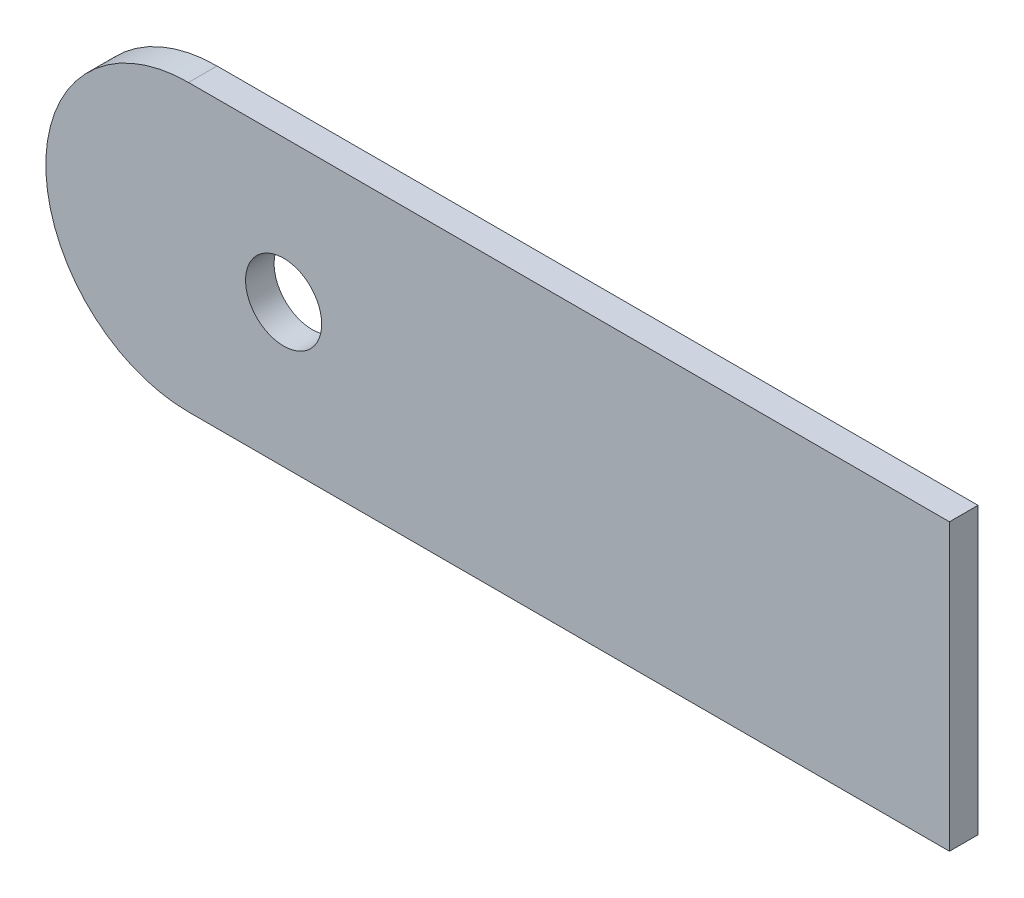
from build123d import *

# Parameters (mm, degrees)
SKETCH1_R           = 4
BOSS_EXTRUDE1_DEPTH = 3


with BuildPart() as part:
    # Sketch1 → Boss-Extrude1 (new body)
    with BuildSketch(Plane.XY):
        with BuildLine():
            Line((-40, 15), (40, 15))
            Line((40, 15), (40, -15))
            Line((40, -15), (-40, -15))
            ThreePointArc((-40, -15), (-55, 0), (-40, 15))
        make_face()
        with Locations((-30, 0)):
            Circle(SKETCH1_R, mode=Mode.SUBTRACT)
    extrude(amount=BOSS_EXTRUDE1_DEPTH)


solid = part.part
